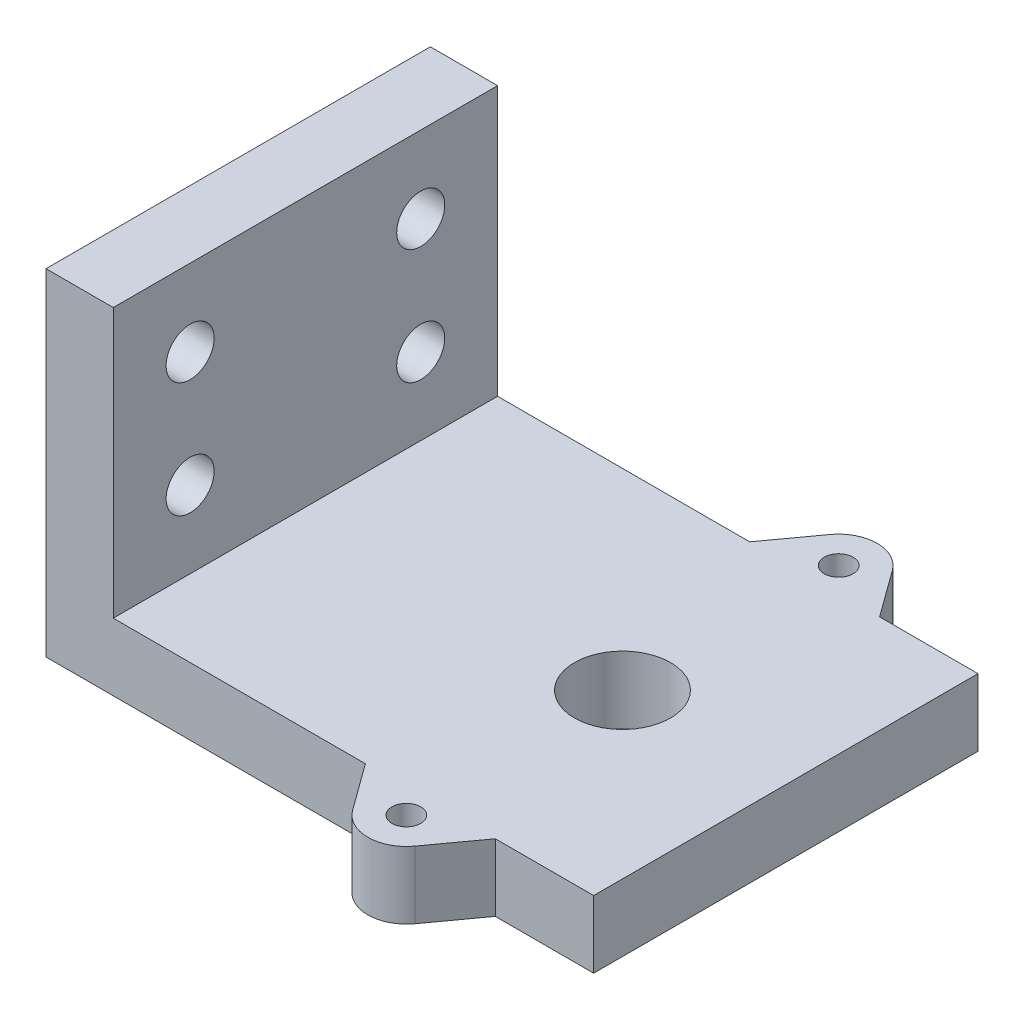
from build123d import *

# Parameters (mm, degrees)
BOSS_EXTRUDE1_DEPTH = 20
SKETCH2_R           = 5
CUT_EXTRUDE1_DEPTH  = 67.580778007
SKETCH3_R           = 2.5
CUT_EXTRUDE2_DEPTH  = 65.226162893
SKETCH4_R           = 1.5
BOSS_EXTRUDE2_DEPTH = 7


with BuildPart() as part:
    # Sketch1 → Boss-Extrude1 (new, symmetric)
    with BuildSketch(Plane.XY):
        Polygon((0, 0), (0, 35), (7, 35), (7, 7), (57, 7), (57, 0), align=None)
    extrude(amount=BOSS_EXTRUDE1_DEPTH, both=True)

    # Sketch2 → Cut-Extrude1 (cut, through all)
    with BuildSketch(Plane(origin=(0, 7, 0), x_dir=(1, 0, 0), z_dir=(0, 1, 0))):
        with Locations(Location((40, 0, 0), (0, 0, 270))):
            Circle(SKETCH2_R)
    extrude(amount=-CUT_EXTRUDE1_DEPTH, mode=Mode.SUBTRACT)

    # Sketch3 → Cut-Extrude2 (cut, through all)
    with BuildSketch(Plane(origin=(7, 0, 0), x_dir=(0, 0, -1), z_dir=(1, 0, 0))):
        with Locations(Location((12, 27, 0), (0, 0, 90))):
            Circle(SKETCH3_R)
        with Locations(Location((12, 15, 0), (0, 0, 90))):
            Circle(SKETCH3_R)
        with Locations(Location((-12, 27, 0), (0, 0, 90))):
            Circle(SKETCH3_R)
        with Locations(Location((-12, 15, 0), (0, 0, 90))):
            Circle(SKETCH3_R)
    extrude(amount=-CUT_EXTRUDE2_DEPTH, mode=Mode.SUBTRACT)

    # Sketch4 → Boss-Extrude2 (add)
    # profile 1 of 2: a face of its own
    with BuildSketch(Plane(origin=(0, 7, 0), x_dir=(1, 0, 0), z_dir=(0, 1, 0))):
        with BuildLine():
            Line((36.764961653, 24.852557521), (33.236125371, 20))
            Line((33.236125371, 20), (46.763874629, 20))
            Line((46.763874629, 20), (43.235038347, 24.852557521))
            ThreePointArc((43.235038347, 24.852557521), (40, 26.5), (36.764961653, 24.852557521))
        make_face()
        with Locations(Location((40, 22.5, 0), (0, 0, 270))):
            Circle(SKETCH4_R, mode=Mode.SUBTRACT)
    # profile 2 of 2: a face of its own
    with BuildSketch(Plane(origin=(0, 7, 0), x_dir=(1, 0, 0), z_dir=(0, 1, 0))):
        with BuildLine():
            Line((43.235038347, -24.852557521), (46.763874629, -20))
            Line((46.763874629, -20), (33.236125371, -20))
            Line((33.236125371, -20), (36.764961653, -24.852557521))
            ThreePointArc((36.764961653, -24.852557521), (40, -26.5), (43.235038347, -24.852557521))
        make_face()
        with Locations(Location((40, -22.5, 0), (0, 0, 270))):
            Circle(SKETCH4_R, mode=Mode.SUBTRACT)
    extrude(amount=-BOSS_EXTRUDE2_DEPTH)


solid = part.part
